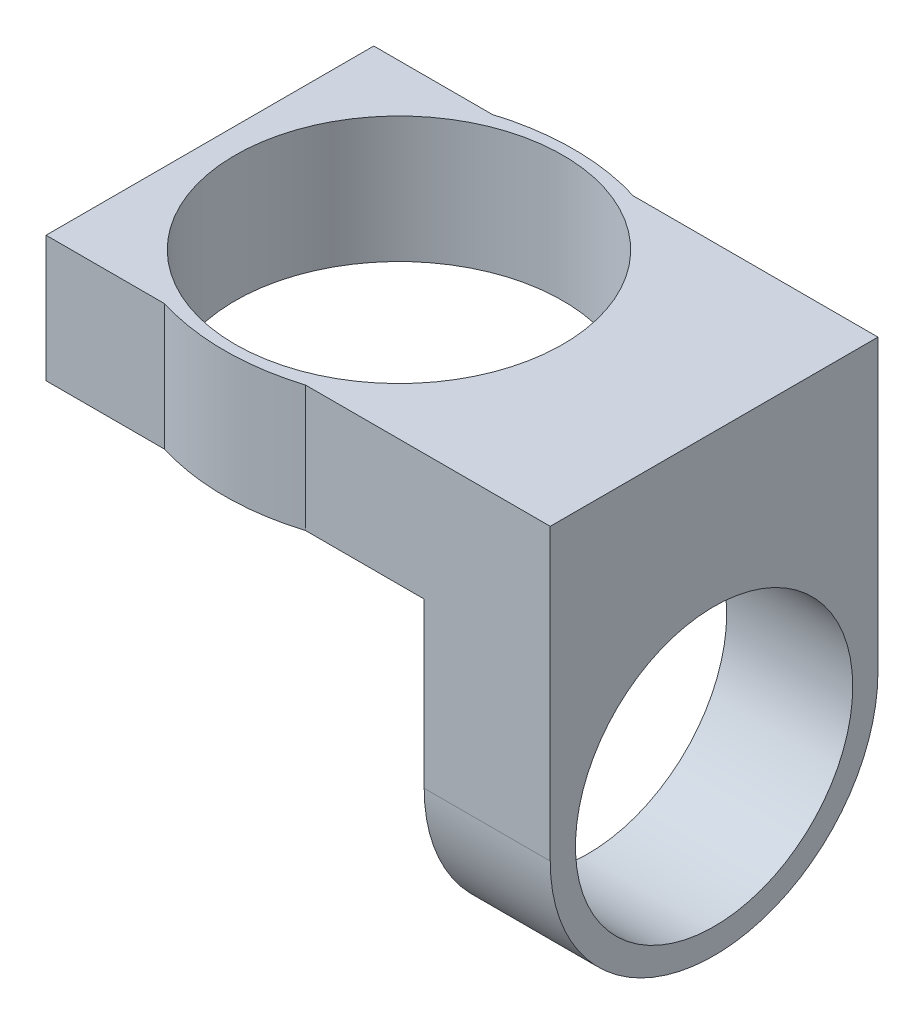
from build123d import *

# Parameters (mm, degrees)
SKETCH1_R                = 13
SKETCH1_R_2              = 11
BOSS_EXTRUDE1_DEPTH      = 10
BOSS_EXTRUDE2_REACH      = 32.741
BOSS_EXTRUDE2_END_RADIUS = 13
SKETCH2_W                = 10
SKETCH2_H                = 26
SKETCH2_3_R              = 13
BOSS_EXTRUDE3_DEPTH      = 10


with BuildPart() as part:
    # Sketch1 → Boss-Extrude1 (new body)
    with BuildSketch(Plane(origin=(0, 0, 0), x_dir=(0, 0, -1), z_dir=(1, 0, 0))):
        Circle(SKETCH1_R)
        Circle(SKETCH1_R_2, mode=Mode.SUBTRACT)
    extrude(amount=BOSS_EXTRUDE1_DEPTH)

    # Boss-Extrude2: up to this cylinder (the profile starts outside it)
    boss_extrude2_end = Plane(origin=(5, 0, 0), z_dir=(-1, 0, 0)) * Cylinder(BOSS_EXTRUDE2_END_RADIUS, 92.482, mode=Mode.PRIVATE)
    # Sketch2 → Boss-Extrude2 (add, up to the surface)
    with BuildSketch(Plane(origin=(0, 13, 0), x_dir=(1, 0, 0), z_dir=(0, 1, 0)), mode=Mode.PRIVATE) as boss_extrude2_sk1:
        with Locations((5, 0)):
            Rectangle(SKETCH2_W, SKETCH2_H)
    boss_extrude2_tool1 = extrude(boss_extrude2_sk1.sketch, amount=-BOSS_EXTRUDE2_REACH, mode=Mode.PRIVATE) - boss_extrude2_end
    add(boss_extrude2_tool1.solids().sort_by_distance((5, 13, 0))[0])
    add(boss_extrude2_tool1.solids().sort_by_distance((5, 13, 0))[1])

    # Sketch2<3> → Boss-Extrude3 (add)
    with BuildSketch(Plane(origin=(0, 13, 0), x_dir=(1, 0, 0), z_dir=(0, 1, 0))):
        with BuildLine():
            Line((10, -13), (10, 13))
            Line((10, 13), (-9.411981237, 13))
            ThreePointArc((-9.411981237, 13), (-15, 13.845319391), (-20.588018763, 13))
            Line((-20.588018763, 13), (-30, 13))
            Line((-30, 13), (-30, -13))
            Line((-30, -13), (-20.588018763, -13))
            ThreePointArc((-20.588018763, -13), (-15, -13.845319391), (-9.411981237, -13))
            Line((-9.411981237, -13), (10, -13))
        make_face()
        with Locations((-15, 0)):
            Circle(SKETCH2_3_R, mode=Mode.SUBTRACT)
    extrude(amount=BOSS_EXTRUDE3_DEPTH)


solid = part.part
